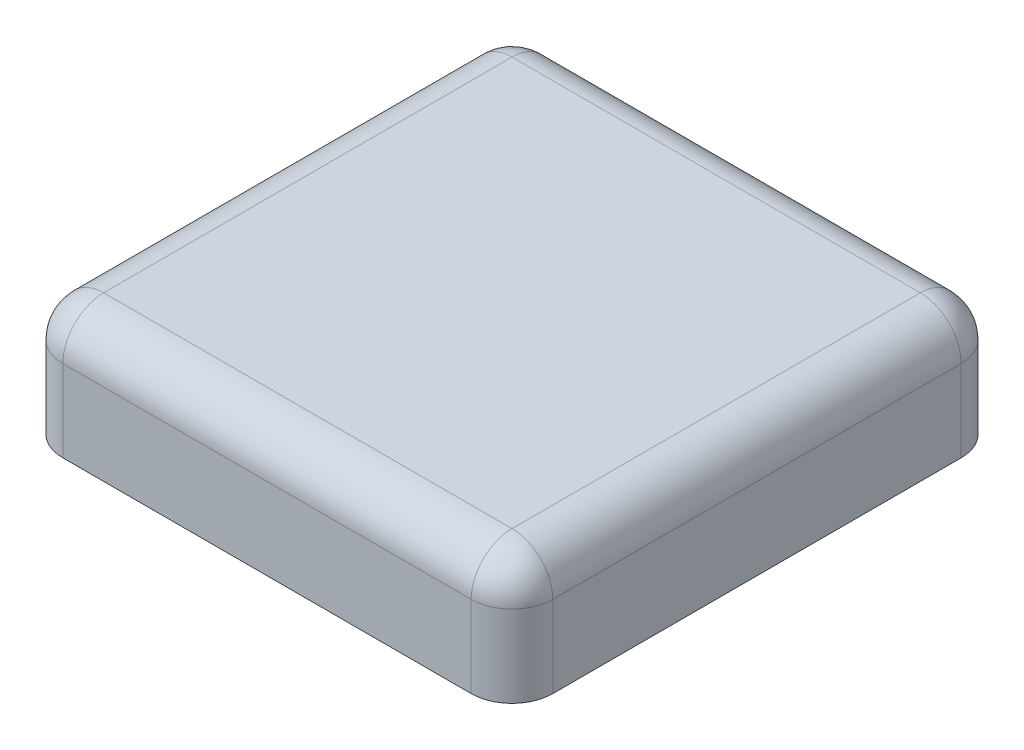
from build123d import *

# Parameters (mm, degrees)
SKETCH1_W           = 304.8
SKETCH1_H           = 304.8
BOSS_EXTRUDE2_DEPTH = 38.1
FILLET1_R           = 25.4


with BuildPart() as part:
    # Sketch1 → Boss-Extrude2 (new, symmetric)
    with BuildSketch(Plane(origin=(0, 0, 0), x_dir=(1, 0, 0), z_dir=(0, 1, 0))):
        with Locations((152.4, -152.4)):
            Rectangle(SKETCH1_W, SKETCH1_H)
    extrude(amount=BOSS_EXTRUDE2_DEPTH, both=True)

    # Fillet1
    fillet1_edges = [part.edges().sort_by_distance(p)[0] for p in [
        (152.4, 38.1, 304.8),
        (0, 38.1, 152.4),
        (152.4, 38.1, 0),
        (0, 0, 0),
        (0, 0, 304.8),
        (304.8, 0, 304.8),
        (304.8, 0, 0),
        (304.8, 38.1, 152.4),
    ]]
    fillet(fillet1_edges, radius=FILLET1_R)


solid = part.part
